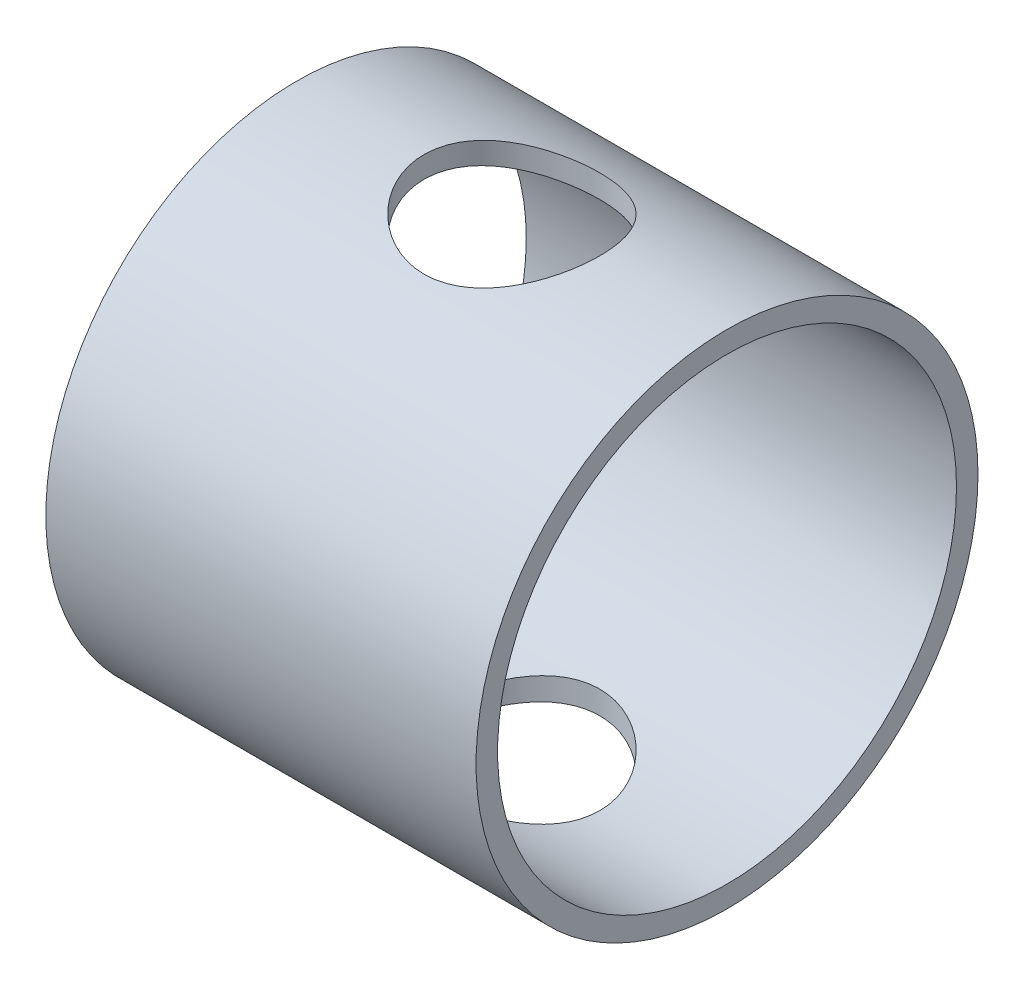
from build123d import *

# Parameters (mm, degrees)
SKETCH1_R               = 35
SKETCH1_R_2             = 32
BOSS_EXTRUDE1_DEPTH     = 60
CUT_EXTRUDE1_DEPTH      = 78.781745931
CUT_EXTRUDE1_DEPTH_BACK = 78.781745931
SKETCH2_R               = 12.25


with BuildPart() as part:
    # Sketch1 → Boss-Extrude1 (new body)
    with BuildSketch(Plane(origin=(0, 0, 0), x_dir=(0, 0, -1), z_dir=(1, 0, 0))):
        Circle(SKETCH1_R)
        Circle(SKETCH1_R_2, mode=Mode.SUBTRACT)
    extrude(amount=BOSS_EXTRUDE1_DEPTH)

    # Sketch2 → Cut-Extrude1 (cut, two sides: drawn at the far end of the back side and taken through both)
    with BuildSketch(Plane(origin=(0, 0, 0), x_dir=(1, 0, 0), z_dir=(0, 1, 0)).offset(-CUT_EXTRUDE1_DEPTH_BACK)):
        with Locations(Location((30, 0, 0), (0, 0, 270))):
            Circle(SKETCH2_R)
    extrude(amount=CUT_EXTRUDE1_DEPTH + CUT_EXTRUDE1_DEPTH_BACK, mode=Mode.SUBTRACT)


solid = part.part
